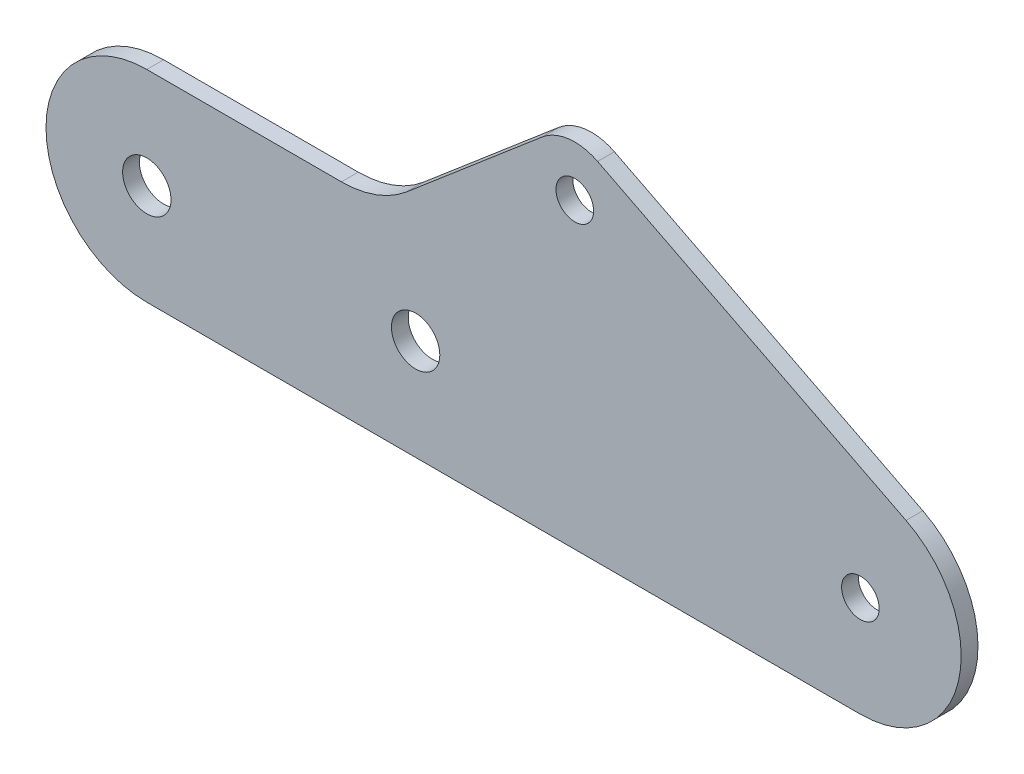
from build123d import *

# Parameters (mm, degrees)
SKETCH1_R           = 2.286
SKETCH1_R_2         = 1.778
BOSS_EXTRUDE1_DEPTH = 1.5875


with BuildPart() as part:
    # Sketch1 → Boss-Extrude1 (new body)
    with BuildSketch(Plane.XY):
        with BuildLine():
            Line((-3.929505469, -9.525), (38.1, -9.525))
            ThreePointArc((38.1, -9.525), (47.363212424, -2.217773791), (42.413639839, 8.492239772))
            Line((42.413639839, 8.492239772), (13.269319919, 23.296119886))
            ThreePointArc((13.269319919, 23.296119886), (10.554316452, 23.779676244), (8.026471806, 22.677373187))
            Line((8.026471806, 22.677373187), (-4.764567756, 11.795253626))
            ThreePointArc((-4.764567756, 11.795253626), (-7.648450959, 10.11056254), (-10.936624143, 9.525))
            Line((-10.936624143, 9.525), (-29.329505469, 9.525))
            ThreePointArc((-29.329505469, 9.525), (-38.854505469, 0), (-29.329505469, -9.525))
            Line((-29.329505469, -9.525), (-3.929505469, -9.525))
        make_face()
        with Locations((-3.929505469, 0)):
            Circle(SKETCH1_R, mode=Mode.SUBTRACT)
        with Locations((38.1, 0)):
            Circle(SKETCH1_R_2, mode=Mode.SUBTRACT)
        with Locations((11.1125, 19.05)):
            Circle(SKETCH1_R_2, mode=Mode.SUBTRACT)
        with Locations((-29.329505469, 0)):
            Circle(SKETCH1_R, mode=Mode.SUBTRACT)
    extrude(amount=BOSS_EXTRUDE1_DEPTH)


solid = part.part
